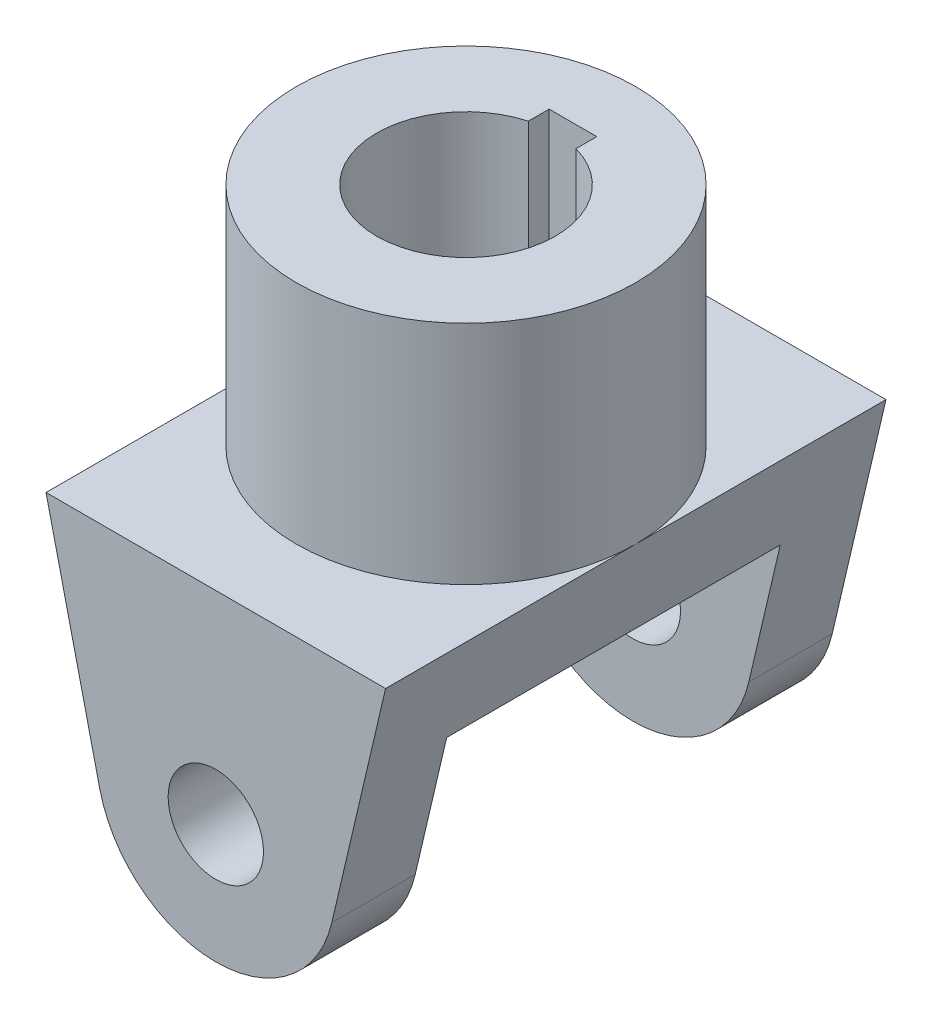
from build123d import *

# Parameters (mm, degrees)
SKETCH1_R           = 28.5
SKETCH1_R_2         = 15
BOSS_EXTRUDE1_DEPTH = 38
SKETCH2_W           = 57
SKETCH2_H           = 84
BOSS_EXTRUDE2_DEPTH = 16
SKETCH6_W           = 57
SKETCH6_H           = 38
BOSS_EXTRUDE4_DEPTH = 14
SKETCH7_W           = 57
SKETCH7_H           = 38
BOSS_EXTRUDE5_DEPTH = 14
SKETCH8_R           = 8
CUT_EXTRUDE3_DEPTH  = 104.847243584
CUT_EXTRUDE4_DEPTH  = 104.847243584
CUT_EXTRUDE5_START  = -38
CUT_EXTRUDE5_DEPTH  = 38
ESCALA1_SCALE       = 0.5


with BuildPart() as part:
    # Sketch1 → Boss-Extrude1 (new body)
    with BuildSketch(Plane(origin=(0, 0, 0), x_dir=(1, 0, 0), z_dir=(0, 1, 0))):
        with Locations(Location((0, 0, 0), (0, 0, 270))):
            Circle(SKETCH1_R)
        with Locations(Location((0, 0, 0), (0, 0, 270))):
            Circle(SKETCH1_R_2, mode=Mode.SUBTRACT)
    extrude(amount=BOSS_EXTRUDE1_DEPTH)

    # Sketch2 → Boss-Extrude2 (add)
    with BuildSketch(Plane.XZ):
        Rectangle(SKETCH2_W, SKETCH2_H)
    extrude(amount=BOSS_EXTRUDE2_DEPTH)

    # Sketch6 → Boss-Extrude4 (add)
    with BuildSketch(Plane.XY.offset(42)):
        with Locations((0, -35)):
            Rectangle(SKETCH6_W, SKETCH6_H)
    extrude(amount=-BOSS_EXTRUDE4_DEPTH)

    # Sketch7 → Boss-Extrude5 (add)
    with BuildSketch(Plane(origin=(0, 0, -42), x_dir=(-1, 0, 0), z_dir=(0, 0, -1))):
        with Locations((0, -35)):
            Rectangle(SKETCH7_W, SKETCH7_H)
    extrude(amount=-BOSS_EXTRUDE5_DEPTH)

    # Sketch8 → Cut-Extrude3 (cut, through all)
    with BuildSketch(Plane(origin=(0, 0, -42), x_dir=(-1, 0, 0), z_dir=(0, 0, -1))):
        with Locations((0, -34)):
            Circle(SKETCH8_R)
    extrude(amount=-CUT_EXTRUDE3_DEPTH, mode=Mode.SUBTRACT)

    # Sketch9 → Cut-Extrude4 (cut, through all)
    with BuildSketch(Plane.XY.offset(42)):
        with BuildLine():
            Line((-19.473528625, -38.558693112), (-28.5, 0))
            Line((-28.5, 0), (-28.5, -54))
            Line((-28.5, -54), (0, -54))
            ThreePointArc((0, -54), (-12.42630552, -49.671213454), (-19.473528625, -38.558693112))
        make_face()
        with BuildLine():
            ThreePointArc((19.473522225, -38.558720453), (12.426294519, -49.671222177), (0, -54))
            Line((0, -54), (28.5, -54))
            Line((28.5, -54), (28.5, 0))
            Line((28.5, 0), (19.473522225, -38.558720453))
        make_face()
    extrude(amount=-CUT_EXTRUDE4_DEPTH, mode=Mode.SUBTRACT)

    # Sketch11 → Cut-Extrude5 (cut)
    with BuildSketch(Plane(origin=(0, 38, 0), x_dir=(1, 0, 0), z_dir=(0, 1, 0)).offset(CUT_EXTRUDE5_START)):
        with BuildLine():
            Line((-4, 17.956832295), (4, 17.956832295))
            Line((4, 17.956832295), (4, 14.456832295))
            ThreePointArc((4, 14.456832295), (0, 15), (-4, 14.456832295))
            Line((-4, 14.456832295), (-4, 17.956832295))
        make_face()
    extrude(amount=CUT_EXTRUDE5_DEPTH, mode=Mode.SUBTRACT)


with BuildPart() as part_1:
    # Escala1: scaled about (0, -2.092250253, 0.088985483)
    add(part.part.scale(ESCALA1_SCALE).moved(Location((0, -1.046125127, 0.044492742))))


solid = part_1.part
